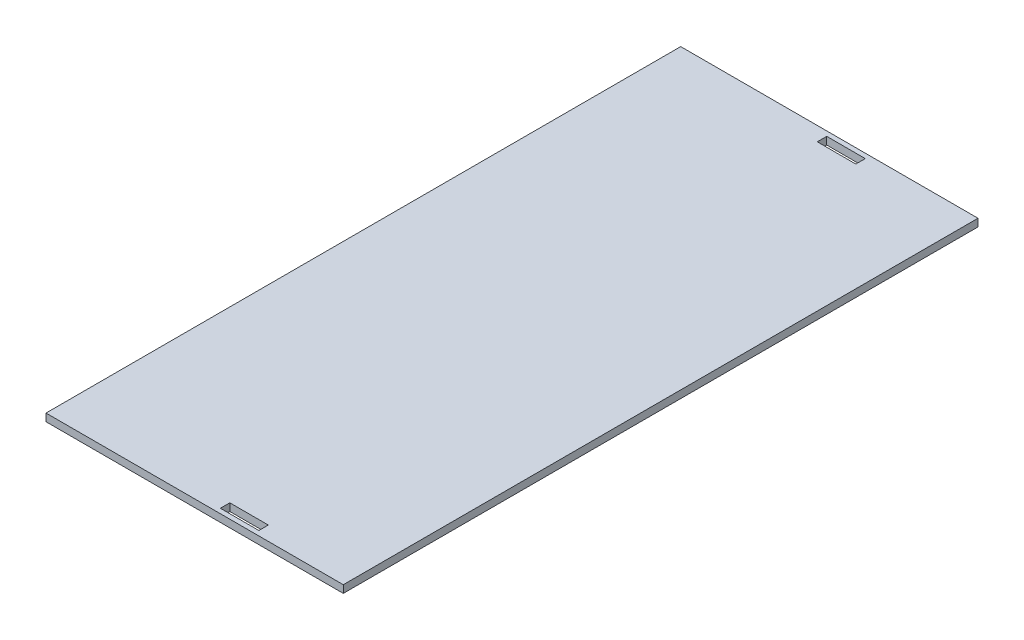
from build123d import *

# Parameters (mm, degrees)
SKETCH1_W           = 78.69
SKETCH1_H           = 168
BOSS_EXTRUDE1_DEPTH = 2
SKETCH2_W           = 10.2
SKETCH2_H           = 2.5
CUT_EXTRUDE1_DEPTH  = 5
SKETCH3_W           = 10.2
SKETCH3_H           = 2.5
CUT_EXTRUDE2_DEPTH  = 2


with BuildPart() as part:
    # Sketch1 → Boss-Extrude1 (new body)
    with BuildSketch(Plane(origin=(0, 0, 0), x_dir=(1, 0, 0), z_dir=(0, 1, 0))):
        Rectangle(SKETCH1_W, SKETCH1_H)
    extrude(amount=BOSS_EXTRUDE1_DEPTH)

    # Sketch2 → Cut-Extrude1 (cut)
    with BuildSketch(Plane(origin=(0, 2, 0), x_dir=(1, 0, 0), z_dir=(0, 1, 0))):
        with Locations((5.655, 81.5)):
            Rectangle(SKETCH2_W, SKETCH2_H)
    extrude(amount=-CUT_EXTRUDE1_DEPTH, mode=Mode.SUBTRACT)

    # Sketch3 → Cut-Extrude2 (cut)
    with BuildSketch(Plane(origin=(0, 2, 0), x_dir=(1, 0, 0), z_dir=(0, 1, 0))):
        with Locations((10.65116, -81.5)):
            Rectangle(SKETCH3_W, SKETCH3_H)
    extrude(amount=-CUT_EXTRUDE2_DEPTH, mode=Mode.SUBTRACT)


solid = part.part
